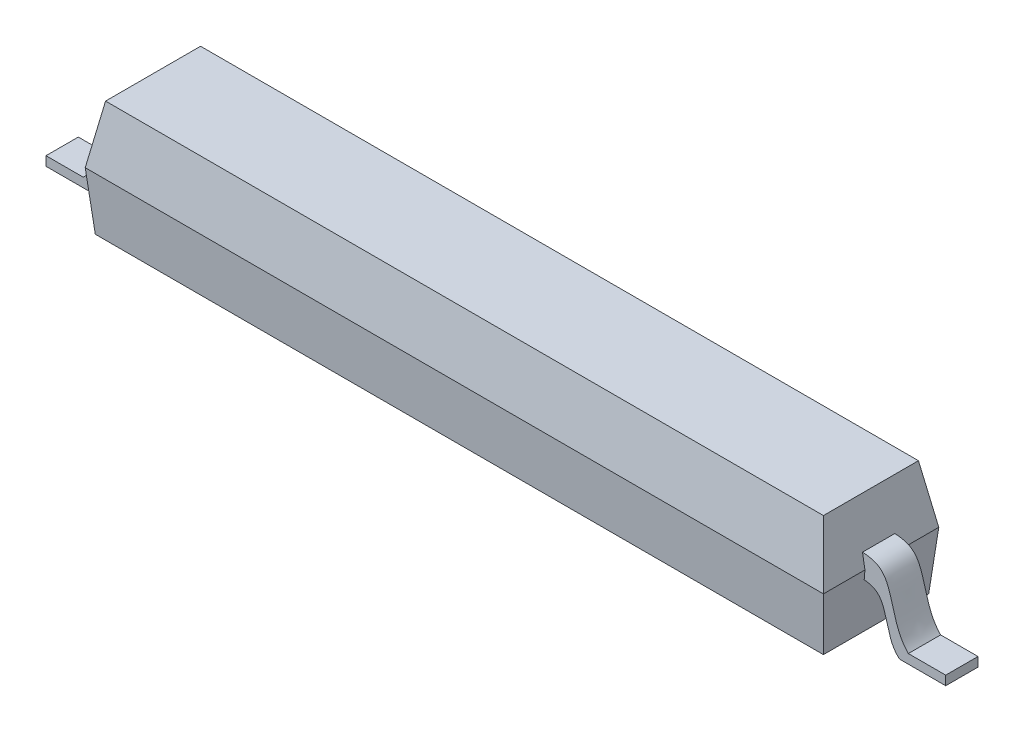
from build123d import *

# Parameters (mm, degrees)
SKETCH_2_W                = 16
SKETCH_2_H                = 2.5
EXTRUDE_1_DEPTH           = 1.25
EXTRUDE_1_TAPER           = 10
EXTRUDE_1_OTHER_WAY_DEPTH = 1.25
EXTRUDE_1_OTHER_WAY_TAPER = 5
EXTRUDE_2_DEPTH           = 0.35


with BuildPart() as part:
    # Эскиз2 → Бобышка-Вытянуть1 (new body)
    with BuildSketch(Plane(origin=(0, 0, 0), x_dir=(1, 0, 0), z_dir=(0, 1, 0))):
        Rectangle(SKETCH_2_W, SKETCH_2_H)
    extrude(amount=EXTRUDE_1_DEPTH, taper=EXTRUDE_1_TAPER)

    # Эскиз2 → Бобышка-Вытянуть1 other way (add)
    with BuildSketch(Plane(origin=(0, 0, 0), x_dir=(1, 0, 0), z_dir=(0, 1, 0))):
        Rectangle(SKETCH_2_W, SKETCH_2_H)
    extrude(amount=-EXTRUDE_1_OTHER_WAY_DEPTH, taper=EXTRUDE_1_OTHER_WAY_TAPER)

    # Эскиз3 → Бобышка-Вытянуть2 (add, symmetric)
    with BuildSketch(Plane.XY):
        with BuildLine():
            Line((-8.94, -1.1), (-9.75, -1.1))
            Line((-9.75, -1.1), (-9.75, -1.3))
            Line((-9.75, -1.3), (-8.75, -1.3))
            add(Edge.make_bspline(
                [(-8.75, -1.3), (-8.598827161, -1.168647342), (-8.520234343, -0.919812082), (-8.367054145, -0.306395683), (-8.139808897, -0.193393407), (-7.92698735, -0.193393407)],
                knots=[0, 0, 0, 0, 0.417832957, 0.685176508, 1, 1, 1, 1], degree=3))
            Line((-7.92698735, -0.193393407), (-7.373029008, -0.193393407))
            Line((-7.373029008, -0.193393407), (-7.373029008, 0.306606593))
            Line((-7.373029008, 0.306606593), (-7.889795637, 0.306606593))
            add(Edge.make_bspline(
                [(-8.94, -1.1), (-8.782709202, -0.94416904), (-8.601427611, -0.451853298), (-8.504762441, 0.074209929), (-8.230463242, 0.306606593), (-7.889795637, 0.306606593)],
                knots=[0, 0, 0, 0, 0.318526042, 0.678515107, 1, 1, 1, 1], degree=3))
        make_face()
    extrude_2 = extrude(amount=EXTRUDE_2_DEPTH, both=True)

    # Зеркальное отражение1: Бобышка-Вытянуть2 across plane
    add(extrude_2.mirror(Plane(origin=(0, 0, 0), x_dir=(0, 0, 1), z_dir=(1, 0, 0))))


solid = part.part
